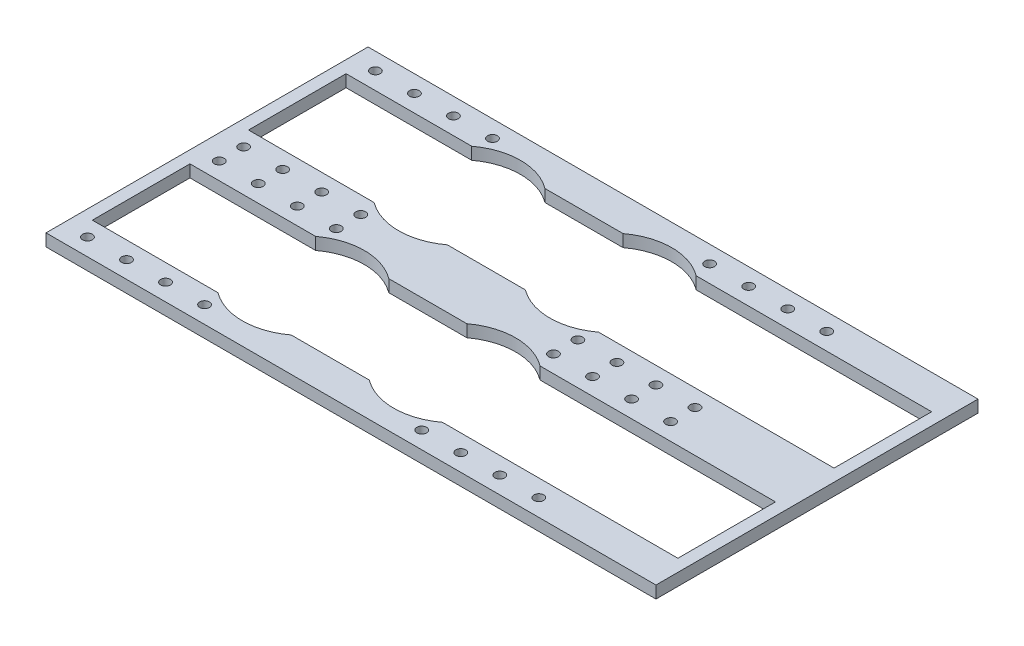
from build123d import *

# Parameters (mm, degrees)
SKETCH1_W           = 160
SKETCH1_H           = 66
BOSS_EXTRUDE1_DEPTH = 40
SKETCH2_R           = 4.025
SKETCH2_W           = 130
SKETCH2_H           = 37.5
CUT_EXTRUDE1_DEPTH  = 112.157545853
SKETCH3_R           = 1
SKETCH3_W           = 120
SKETCH3_H           = 20
CUT_EXTRUDE2_DEPTH  = 96.336247042
SKETCH4_R           = 12.5
CUT_EXTRUDE3_DEPTH  = 95.314633011
SKETCH5_W           = 35
SKETCH5_H           = 66
CUT_EXTRUDE5_DEPTH  = 96.336247042


with BuildPart() as part:
    # Sketch1 → Boss-Extrude1 (new body)
    with BuildSketch(Plane(origin=(0, 0, 0), x_dir=(1, 0, 0), z_dir=(0, 1, 0))):
        Rectangle(SKETCH1_W, SKETCH1_H)
    extrude(amount=BOSS_EXTRUDE1_DEPTH)

    # Sketch2 → Cut-Extrude1 (cut, through all)
    with BuildSketch(Plane.XY.offset(33)):
        with Locations((70, 20)):
            Circle(SKETCH2_R)
        with Locations((-15, 21.25)):
            Rectangle(SKETCH2_W, SKETCH2_H)
    extrude(amount=-CUT_EXTRUDE1_DEPTH, mode=Mode.SUBTRACT)

    # Sketch3 → Cut-Extrude2 (cut, through all)
    with BuildSketch(Plane(origin=(0, 40, 0), x_dir=(1, 0, 0), z_dir=(0, 1, 0))):
        with Locations(Location((-75, 29.5, 0), (0, 0, 270))):
            Circle(SKETCH3_R)
        with Locations(Location((-75, 2.5, 0), (0, 0, 270))):
            Circle(SKETCH3_R)
        with Locations(Location((-67, 29.5, 0), (0, 0, 270))):
            Circle(SKETCH3_R)
        with Locations(Location((-59, 29.5, 0), (0, 0, 270))):
            Circle(SKETCH3_R)
        with Locations(Location((-51, 29.5, 0), (0, 0, 270))):
            Circle(SKETCH3_R)
        with Locations(Location((-67, 2.5, 0), (0, 0, 270))):
            Circle(SKETCH3_R)
        with Locations(Location((-59, 2.5, 0), (0, 0, 270))):
            Circle(SKETCH3_R)
        with Locations(Location((-51, 2.5, 0), (0, 0, 270))):
            Circle(SKETCH3_R)
        with Locations(Location((-6.5, 29.5, 0), (0, 0, 270))):
            Circle(SKETCH3_R)
        with Locations(Location((-6.5, 2.5, 0), (0, 0, 270))):
            Circle(SKETCH3_R)
        with Locations(Location((1.5, 29.5, 0), (0, 0, 270))):
            Circle(SKETCH3_R)
        with Locations(Location((9.5, 29.5, 0), (0, 0, 270))):
            Circle(SKETCH3_R)
        with Locations(Location((17.5, 29.5, 0), (0, 0, 270))):
            Circle(SKETCH3_R)
        with Locations(Location((1.5, 2.5, 0), (0, 0, 270))):
            Circle(SKETCH3_R)
        with Locations(Location((9.5, 2.5, 0), (0, 0, 270))):
            Circle(SKETCH3_R)
        with Locations(Location((17.5, 2.5, 0), (0, 0, 270))):
            Circle(SKETCH3_R)
        with Locations((17.5, -2.5)):
            Circle(SKETCH3_R)
        with Locations((9.5, -2.5)):
            Circle(SKETCH3_R)
        with Locations((1.5, -2.5)):
            Circle(SKETCH3_R)
        with Locations((17.5, -29.5)):
            Circle(SKETCH3_R)
        with Locations((9.5, -29.5)):
            Circle(SKETCH3_R)
        with Locations((1.5, -29.5)):
            Circle(SKETCH3_R)
        with Locations((-6.5, -2.5)):
            Circle(SKETCH3_R)
        with Locations((-6.5, -29.5)):
            Circle(SKETCH3_R)
        with Locations((-51, -2.5)):
            Circle(SKETCH3_R)
        with Locations((-59, -2.5)):
            Circle(SKETCH3_R)
        with Locations((-67, -2.5)):
            Circle(SKETCH3_R)
        with Locations((-51, -29.5)):
            Circle(SKETCH3_R)
        with Locations((-59, -29.5)):
            Circle(SKETCH3_R)
        with Locations((-67, -29.5)):
            Circle(SKETCH3_R)
        with Locations((-75, -2.5)):
            Circle(SKETCH3_R)
        with Locations((-75, -29.5)):
            Circle(SKETCH3_R)
        with Locations((-17.5, 16)):
            Rectangle(SKETCH3_W, SKETCH3_H)
        with Locations((-17.5, -16)):
            Rectangle(SKETCH3_W, SKETCH3_H)
    extrude(amount=-CUT_EXTRUDE2_DEPTH, mode=Mode.SUBTRACT)

    # Sketch4 → Cut-Extrude3 (cut, through all)
    with BuildSketch(Plane(origin=(0, 2.5, 0), x_dir=(1, 0, 0), z_dir=(0, 1, 0))):
        with Locations((-44.25, -16)):
            Circle(SKETCH4_R)
        with Locations((-44.25, 16)):
            Circle(SKETCH4_R)
        with Locations((-13.25, 16)):
            Circle(SKETCH4_R)
        with Locations((-13.25, -16)):
            Circle(SKETCH4_R)
    extrude(amount=-CUT_EXTRUDE3_DEPTH, mode=Mode.SUBTRACT)

    # Sketch5 → Cut-Extrude5 (cut, through all)
    with BuildSketch(Plane(origin=(0, 40, 0), x_dir=(1, 0, 0), z_dir=(0, 1, 0))):
        with Locations((62.5, 0)):
            Rectangle(SKETCH5_W, SKETCH5_H)
    extrude(amount=-CUT_EXTRUDE5_DEPTH, mode=Mode.SUBTRACT)


solid = part.part
